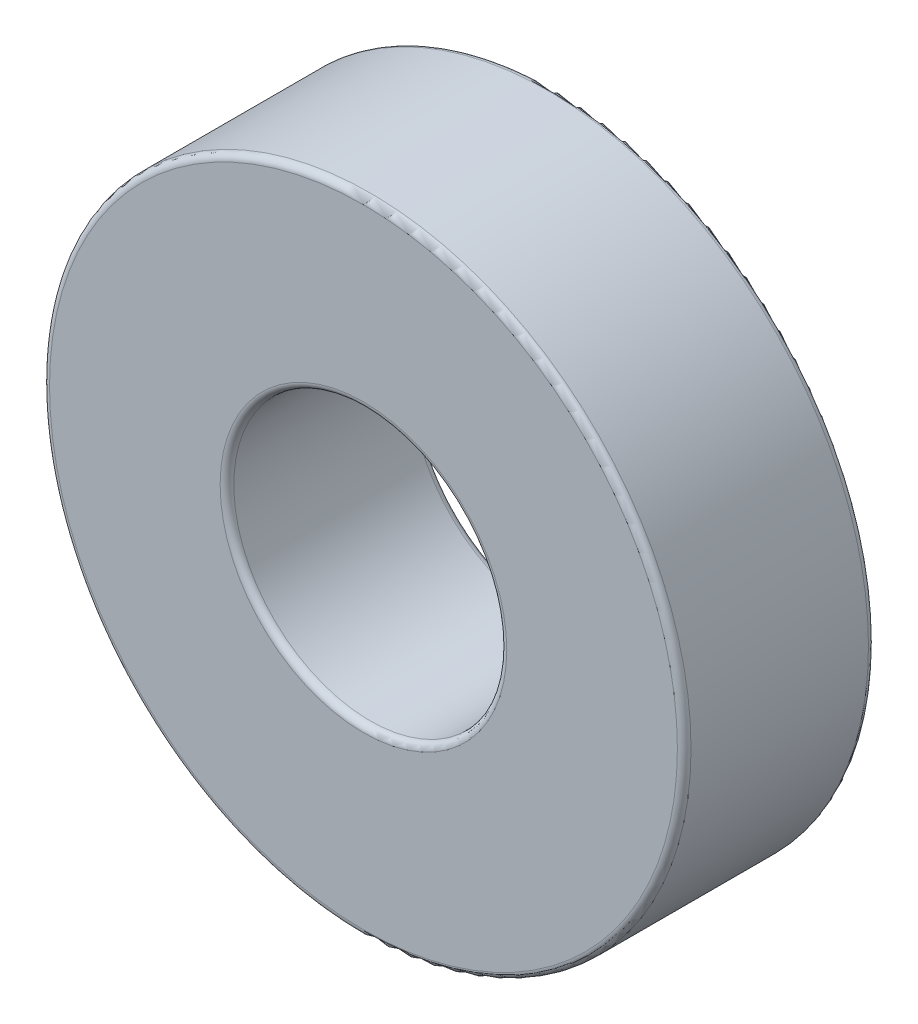
from build123d import *

# Parameters (mm, degrees)
SKETCH_1_R      = 23.5
SKETCH_1_R_2    = 10
EXTRUDE_1_DEPTH = 14
FILLET_1_R      = 0.5


with BuildPart() as part:
    # 草图1 → 拉伸1 (new body)
    with BuildSketch(Plane.XY):
        Circle(SKETCH_1_R)
        Circle(SKETCH_1_R_2, mode=Mode.SUBTRACT)
    extrude(amount=EXTRUDE_1_DEPTH)

    # 圆角1
    fillet_1_edges = [part.edges().sort_by_distance(p)[0] for p in [
        (-23.5, 0, 0),
        (-23.5, 0, 14),
        (-10, 0, 0),
        (-10, 0, 14),
    ]]
    fillet(fillet_1_edges, radius=FILLET_1_R)


solid = part.part
